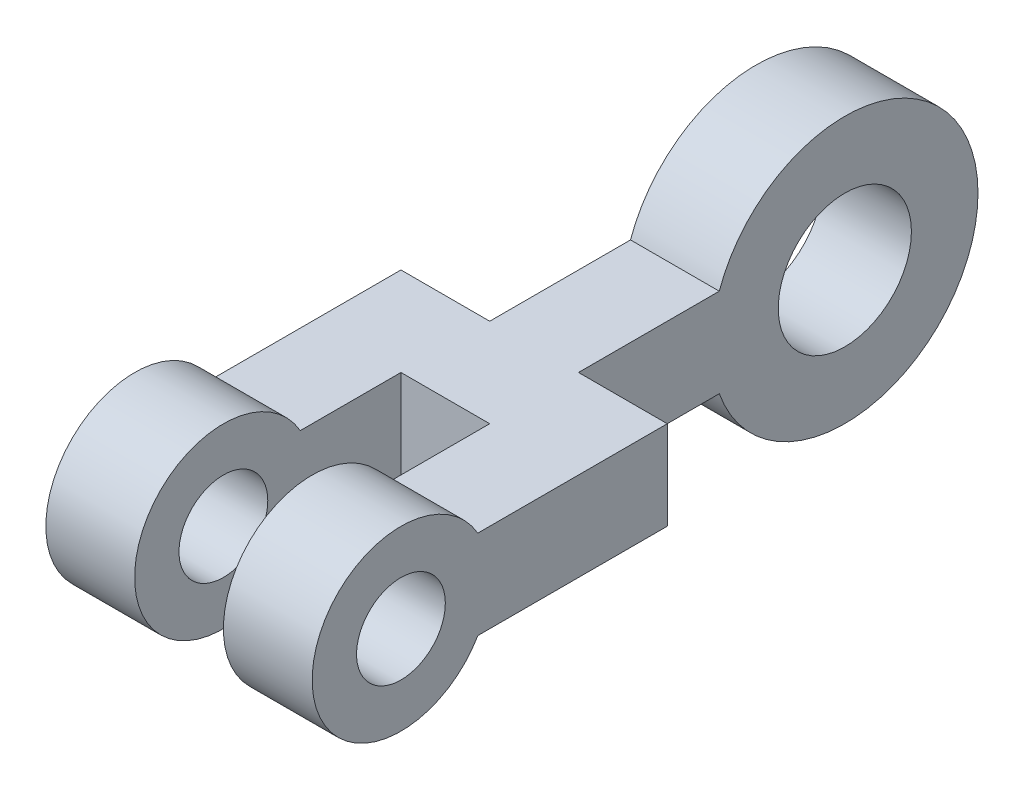
from build123d import *

# Parameters (mm, degrees)
BOSS_EXTRUDE1_DEPTH = 6.35
SKETCH2_R           = 12.7
SKETCH2_R_2         = 6.35
BOSS_EXTRUDE2_DEPTH = 12.7
BOSS_EXTRUDE4_START = -25.4
SKETCH2_3_R         = 12.7
SKETCH2_3_R_2       = 6.35
BOSS_EXTRUDE4_DEPTH = 12.7
BOSS_EXTRUDE5_START = -12.7
SKETCH2_4_R         = 19.05
SKETCH2_4_R_2       = 9.525
BOSS_EXTRUDE5_DEPTH = 12.7
SKETCH2_5_R         = 9.525
CUT_EXTRUDE1_DEPTH  = 117.050484704


with BuildPart() as part:
    # Sketch1 → Boss-Extrude1 (new, symmetric)
    with BuildSketch(Plane(origin=(0, 0, 0), x_dir=(1, 0, 0), z_dir=(0, 1, 0))):
        Polygon((0, 12.7), (12.7, 12.7), (12.7, 38.1), (25.4, 38.1), (25.4, 12.7), (38.1, 12.7), (38.1, 50.8), (25.4, 50.8), (25.4, 88.9), (12.7, 88.9), (12.7, 50.8), (0, 50.8), align=None)
    extrude(amount=BOSS_EXTRUDE1_DEPTH, both=True)

    # Sketch2 → Boss-Extrude2 (add)
    with BuildSketch(Plane(origin=(38.1, 0, 0), x_dir=(0, 0, -1), z_dir=(1, 0, 0))):
        with Locations((12.7, 0)):
            Circle(SKETCH2_R)
        with Locations((12.7, 0)):
            Circle(SKETCH2_R_2, mode=Mode.SUBTRACT)
    extrude(amount=-BOSS_EXTRUDE2_DEPTH)

    # Sketch2<3> → Boss-Extrude4 (add)
    with BuildSketch(Plane(origin=(38.1, 0, 0), x_dir=(0, 0, -1), z_dir=(1, 0, 0)).offset(BOSS_EXTRUDE4_START)):
        with Locations((12.7, 0)):
            Circle(SKETCH2_3_R)
        with Locations((12.7, 0)):
            Circle(SKETCH2_3_R_2, mode=Mode.SUBTRACT)
    extrude(amount=-BOSS_EXTRUDE4_DEPTH)

    # Sketch2<4> → Boss-Extrude5 (add)
    with BuildSketch(Plane(origin=(38.1, 0, 0), x_dir=(0, 0, -1), z_dir=(1, 0, 0)).offset(BOSS_EXTRUDE5_START)):
        with Locations((88.9, 0)):
            Circle(SKETCH2_4_R)
        with Locations((88.9, 0)):
            Circle(SKETCH2_4_R_2, mode=Mode.SUBTRACT)
    extrude(amount=-BOSS_EXTRUDE5_DEPTH)

    # Sketch2<5> → Cut-Extrude1 (cut, through all)
    with BuildSketch(Plane(origin=(38.1, 0, 0), x_dir=(0, 0, -1), z_dir=(1, 0, 0))):
        with BuildLine():
            ThreePointArc((12.7, -6.35), (19.05, 0), (12.7, 6.35))
            Line((12.7, 6.35), (12.7, -6.35))
        make_face()
        with Locations((88.9, 0)):
            Circle(SKETCH2_5_R)
    extrude(amount=-CUT_EXTRUDE1_DEPTH, mode=Mode.SUBTRACT)


solid = part.part
